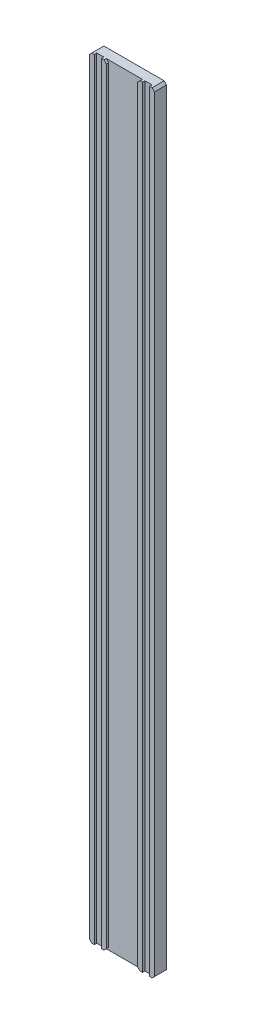
from build123d import *

# Parameters (mm, degrees)
SCHIZZO1_W                        = 6.5
SCHIZZO1_H                        = 80
ESTRUSIONE_ESTRUSIONE1_DEPTH      = 2
SCHIZZO2_W                        = 3
SCHIZZO2_H                        = 320
ESTRUSIONE_ESTRUSIONE2_DEPTH      = 7
SMUSSO1_SIZE                      = 1
SCHIZZO4_W                        = 3
SCHIZZO4_H                        = 1
TAGLIO_ESTRUSIONE1_DEPTH          = 321.298688727
SMUSSO1_OF_SPECCHIA9_SIZE         = 1
ESTRUSIONE_ESTRUSIONE3_DEPTH      = 122
ESTRUSIONE_ESTRUSIONE3_DEPTH_BACK = 200
SCHIZZO5_W                        = 13
SCHIZZO5_H                        = 2
SCHIZZO6_W                        = 13
SCHIZZO6_H                        = 2
TAGLIO_ESTRUSIONE2_DEPTH          = 2
ESTRUSIONE_ESTRUSIONE4_DEPTH      = 2
ESTRUSIONE_ESTRUSIONE5_DEPTH      = 2


with BuildPart() as part:
    # Schizzo1 → Estrusione-Estrusione1 (new body)
    with BuildSketch(Plane.XY):
        with Locations((3.25, 40)):
            Rectangle(SCHIZZO1_W, SCHIZZO1_H)
    estrusione_estrusione1 = extrude(amount=ESTRUSIONE_ESTRUSIONE1_DEPTH)

    # Schizzo2 → Estrusione-Estrusione2 (add)
    with BuildSketch(Plane(origin=(6.5, 0, 0), x_dir=(0, 0, -1), z_dir=(1, 0, 0))):
        with Locations((-1.5, 40)):
            Rectangle(SCHIZZO2_W, SCHIZZO2_H)
    estrusione_estrusione2 = extrude(amount=ESTRUSIONE_ESTRUSIONE2_DEPTH)

    # Smusso1
    smusso1_edges = [part.edges().sort_by_distance(p)[0] for p in [
        (6.5, -120, 1.5),
        (13.5, -120, 1.5),
        (6.5, 200, 1.5),
        (13.5, 200, 1.5),
    ]]
    chamfer(smusso1_edges, length=SMUSSO1_SIZE)

    # Schizzo4 → Taglio-Estrusione1 (cut, through all)
    with BuildSketch(Plane.XZ.offset(120)):
        with Locations((10, 2.5)):
            Rectangle(SCHIZZO4_W, SCHIZZO4_H)
    taglio_estrusione1 = extrude(amount=-TAGLIO_ESTRUSIONE1_DEPTH, mode=Mode.SUBTRACT)

    # Specchia9: Estrusione-Estrusione1, Estrusione-Estrusione2, Taglio-Estrusione1 across plane
    add(estrusione_estrusione1.mirror(Plane.ZY))
    add(estrusione_estrusione2.mirror(Plane.ZY))
    add(taglio_estrusione1.mirror(Plane.ZY), mode=Mode.SUBTRACT)

    # Smusso1 of Specchia9
    smusso1_of_specchia9_edges = [part.edges().sort_by_distance(p)[0] for p in [
        (-6.5, -120, 1.5),
        (-13.5, -120, 1.5),
        (-6.5, 200, 1.5),
        (-13.5, 200, 1.5),
    ]]
    chamfer(smusso1_of_specchia9_edges, length=SMUSSO1_OF_SPECCHIA9_SIZE)

    # Schizzo5 → Estrusione-Estrusione3 (add, two sides: drawn at the far end of the back side and taken through both)
    with BuildSketch(Plane.XZ.offset(-ESTRUSIONE_ESTRUSIONE3_DEPTH_BACK)):
        with Locations((0, 1)):
            Rectangle(SCHIZZO5_W, SCHIZZO5_H)
    extrude(amount=ESTRUSIONE_ESTRUSIONE3_DEPTH + ESTRUSIONE_ESTRUSIONE3_DEPTH_BACK)

    # Schizzo6 → Taglio-Estrusione2 (cut)
    with BuildSketch(Plane.XZ.offset(122)):
        with Locations((0, 1)):
            Rectangle(SCHIZZO6_W, SCHIZZO6_H)
    extrude(amount=-TAGLIO_ESTRUSIONE2_DEPTH, mode=Mode.SUBTRACT)

    # Schizzo7 → Estrusione-Estrusione4 (add)
    with BuildSketch(Plane(origin=(0, 0, 0), x_dir=(-1, 0, 0), z_dir=(0, 0, -1))):
        Polygon((-7.5, 200), (-6.5, 200), (-6.5, 199), align=None)
        Polygon((6.5, 200), (6.5, 199), (7.5, 200), align=None)
        Polygon((-7.5, -120), (-6.5, -120), (-6.5, -119), align=None)
        Polygon((6.5, -119), (6.5, -120), (7.5, -120), align=None)
    extrude(amount=-ESTRUSIONE_ESTRUSIONE4_DEPTH)

    # Schizzo8 → Estrusione-Estrusione5 (add)
    with BuildSketch(Plane(origin=(0, 0, 0), x_dir=(-1, 0, 0), z_dir=(0, 0, -1))):
        Polygon((-13.5, -119), (-12.5, -120), (12.5, -120), (13.5, -119), (13.5, 199), (12.5, 200), (-12.5, 200), (-13.5, 199), align=None)
    extrude(amount=ESTRUSIONE_ESTRUSIONE5_DEPTH)


solid = part.part
